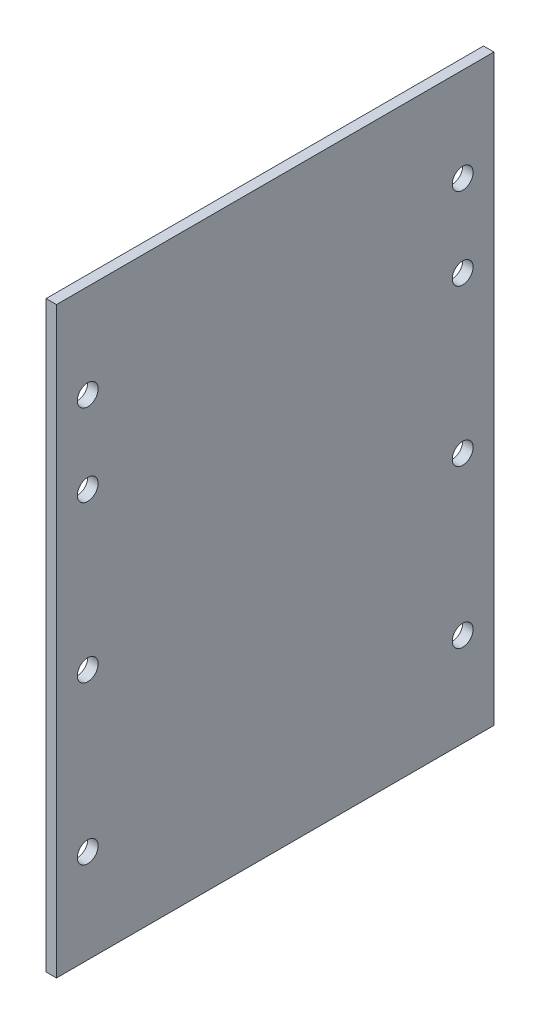
from build123d import *

# Parameters (mm, degrees)
SKETCH1_W           = 133.35
SKETCH1_H           = 177.8
BOSS_EXTRUDE1_DEPTH = 3.175
SKETCH2_R           = 3.175
CUT_EXTRUDE1_DEPTH  = 112.17034789


with BuildPart() as part:
    # Sketch1 → Boss-Extrude1 (new body)
    with BuildSketch(Plane(origin=(0, 0, 0), x_dir=(0, 0, -1), z_dir=(1, 0, 0))):
        Rectangle(SKETCH1_W, SKETCH1_H)
    extrude(amount=-BOSS_EXTRUDE1_DEPTH)

    # Sketch2 → Cut-Extrude1 (cut, through all)
    with BuildSketch(Plane(origin=(0, 0, 0), x_dir=(0, 0, -1), z_dir=(1, 0, 0))):
        with Locations((-57.15, -60.325)):
            Circle(SKETCH2_R)
        with Locations((-57.15, -12.275000088)):
            Circle(SKETCH2_R)
        with Locations(Location((57.15, -12.275000088, 0), (0, 0, 180))):
            Circle(SKETCH2_R)
        with Locations(Location((57.15, -60.325, 0), (0, 0, 180))):
            Circle(SKETCH2_R)
        with Locations((-57.15, 60.325)):
            Circle(SKETCH2_R)
        with Locations((-57.15, 35.349999912)):
            Circle(SKETCH2_R)
        with Locations(Location((57.15, 35.349999912, 0), (0, 0, 180))):
            Circle(SKETCH2_R)
        with Locations(Location((57.15, 60.325, 0), (0, 0, 180))):
            Circle(SKETCH2_R)
    extrude(amount=-CUT_EXTRUDE1_DEPTH, mode=Mode.SUBTRACT)


solid = part.part
